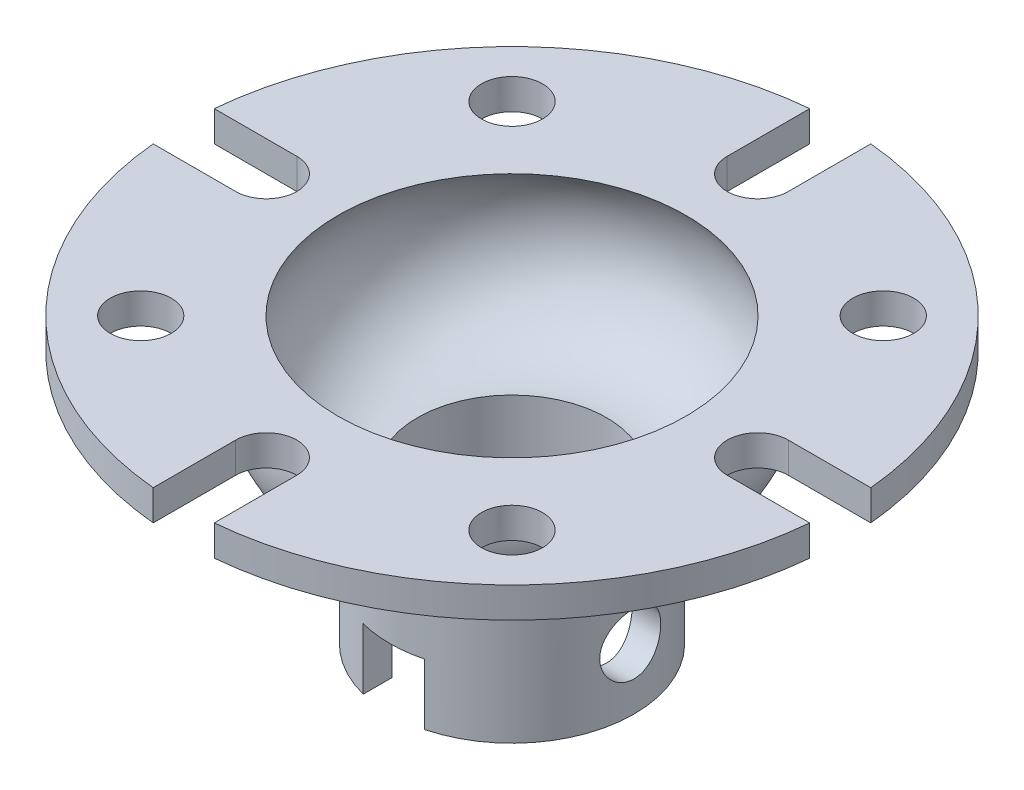
from build123d import *

# Parameters (mm, degrees)
TAGLIO_ESTRUSIONE1_REACH    = 180.821
FORO_20_0_20_1_AT_2_COUNT   = 2
FORO_20_0_20_1_AT_2_PITCH   = 86
RIPETIZIONECIRCOLARE3_COUNT = 4
FORO_20_0_20_3_D            = 20
SCHIZZO12_W                 = 20
SCHIZZO12_H                 = 20
TAGLIO_ESTRUSIONE2_DEPTH    = 189.925496552


with BuildPart() as part:
    # Schizzo1 → Rivoluzione1 (revolve)
    with BuildSketch(Plane.XY):
        with BuildLine():
            Line((-57, 44.4), (-108, 44.4))
            Line((-108, 44.4), (-108, 34.4))
            Line((-108, 34.4), (-67, 34.4))
            ThreePointArc((-67, 34.4), (-61.529931917, 9.694522059), (-40, -3.6))
            Line((-40, -3.6), (-40, -48.6))
            Line((-40, -48.6), (-31, -48.6))
            Line((-31, -48.6), (-31, 0))
            ThreePointArc((-31, 0), (-58.010409132, 13.995706364), (-57, 44.4))
        make_face()
    revolve(axis=Axis((0, 66.063782364, 0), (0, -1, 0)))

    # Schizzo2 → Taglio-Estrusione1 (cut, up to next)
    with BuildSketch(Plane(origin=(0, 44.4, 0), x_dir=(1, 0, 0), z_dir=(0, 1, 0)), mode=Mode.PRIVATE) as taglio_estrusione1_sk1:
        with BuildLine():
            Line((-10, 80.5), (-10, 135.944022788))
            ThreePointArc((-10, 135.944022788), (0, 145.944022788), (10, 135.944022788))
            Line((10, 135.944022788), (10, 80.5))
            ThreePointArc((10, 80.5), (0, 70.5), (-10, 80.5))
        make_face()
    taglio_estrusione1_tool1 = extrude(taglio_estrusione1_sk1.sketch, amount=-TAGLIO_ESTRUSIONE1_REACH, mode=Mode.PRIVATE) & part.part
    taglio_estrusione1 = taglio_estrusione1_tool1.solids().sort_by_distance((0, 44.4, -108.222011))[0]
    add(taglio_estrusione1, mode=Mode.SUBTRACT)

    # Schizzo4 → Foro Ø20.0 (20)-1 (revolve, cut)
    with BuildSketch(Plane(origin=(-60.811183182, 44.4, -60.811183182), x_dir=(0, 0, 1), z_dir=(1, 0, 0))):
        Polygon((0, 0), (0, 41.00860619), (10, 35), (10, 0), align=None)
    foro_20_0_20_1 = revolve(axis=Axis((-60.811183182, 50.75, -60.811183182), (0, -1, 0)), mode=Mode.SUBTRACT)

    # Foro Ø20.0 (20)-1 at 2: Foro Ø20.0 (20)-1 ×2
    with Locations(*[Vector(0.7071067811865489, 0, 0.7071067811865462) * (i * FORO_20_0_20_1_AT_2_PITCH) for i in range(1, FORO_20_0_20_1_AT_2_COUNT)]):
        add(foro_20_0_20_1, mode=Mode.SUBTRACT)

    # RipetizioneCircolare3: Taglio-Estrusione1, Foro Ø20.0 (20)-1 ×4 about axis
    ripetizionecircolare3_axis = Axis((0, 0, 0), (0, -1, 0))
    add([taglio_estrusione1.rotate(ripetizionecircolare3_axis, i * 360 / RIPETIZIONECIRCOLARE3_COUNT) for i in range(1, RIPETIZIONECIRCOLARE3_COUNT)], mode=Mode.SUBTRACT)
    add([foro_20_0_20_1.rotate(ripetizionecircolare3_axis, i * 360 / RIPETIZIONECIRCOLARE3_COUNT) for i in range(1, RIPETIZIONECIRCOLARE3_COUNT)], mode=Mode.SUBTRACT)

    # RipetizioneCircolare3 copy 1 sketch → RipetizioneCircolare3 copy 1 (revolve, cut)
    with BuildSketch(Plane(origin=(0, 44.4, 0), x_dir=(-1, 0, 0), z_dir=(0, 0, 1))):
        Polygon((0, 0), (0, 41.00860619), (10, 35), (10, 0), align=None)
    revolve(axis=Axis((0, 50.75, 0), (0, -1, 0)), mode=Mode.SUBTRACT)

    # RipetizioneCircolare3 copy 2 sketch → RipetizioneCircolare3 copy 2 (revolve, cut)
    with BuildSketch(Plane(origin=(0, 44.4, 0), x_dir=(0, 0, -1), z_dir=(-1, 0, 0))):
        Polygon((0, 0), (0, 41.00860619), (10, 35), (10, 0), align=None)
    revolve(axis=Axis((0, 50.75, 0), (0, -1, 0)), mode=Mode.SUBTRACT)

    # RipetizioneCircolare3 copy 3 sketch → RipetizioneCircolare3 copy 3 (revolve, cut)
    with BuildSketch(Plane(origin=(0, 44.4, 0), x_dir=(1, 0, 0), z_dir=(0, 0, -1))):
        Polygon((0, 0), (0, 41.00860619), (10, 35), (10, 0), align=None)
    revolve(axis=Axis((0, 50.75, 0), (0, -1, 0)), mode=Mode.SUBTRACT)

    # Foro Ø20.0 (20)-3 (through all)
    with Locations(Plane(origin=(40, 0, 0), x_dir=(0, 0, -1), z_dir=(1, 0, 0))):
        with Locations((0, -28.6)):
            Hole(FORO_20_0_20_3_D / 2)

    # Schizzo12 → Taglio-Estrusione2 (cut, through all)
    with BuildSketch(Plane(origin=(0, 0, -40), x_dir=(-1, 0, 0), z_dir=(0, 0, -1))):
        with Locations((0, -38.6)):
            Rectangle(SCHIZZO12_W, SCHIZZO12_H)
    extrude(amount=-TAGLIO_ESTRUSIONE2_DEPTH, mode=Mode.SUBTRACT)


solid = part.part
